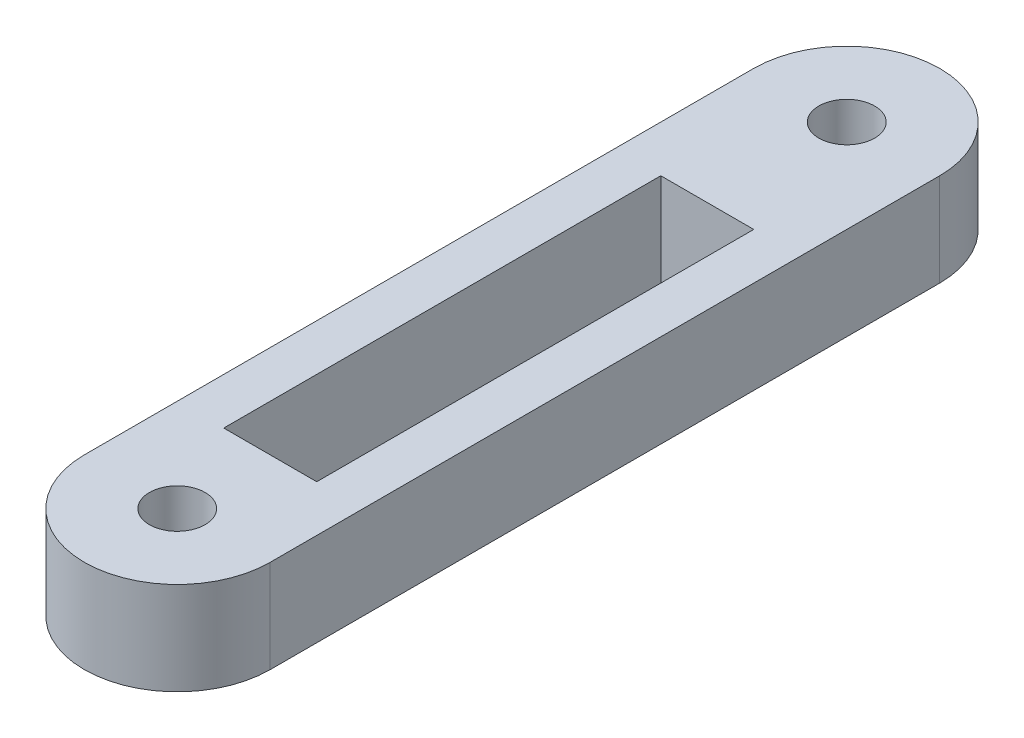
from build123d import *

# Parameters (mm, degrees)
EXTRUDE_1_DEPTH     = 5
SKETCH_3_W          = 5
SKETCH_3_H          = 23.5
CUT_EXTRUDE_1_DEPTH = 5
SKETCH_4_R          = 1.5
CUT_EXTRUDE_2_DEPTH = 5


with BuildPart() as part:
    # 草图2 → 凸台-拉伸1 (new body)
    with BuildSketch(Plane(origin=(0, 0, 0), x_dir=(1, 0, 0), z_dir=(0, 1, 0))):
        with BuildLine():
            Line((5, 18), (5, -18))
            ThreePointArc((5, -18), (0, -23), (-5, -18))
            Line((-5, -18), (-5, 18))
            ThreePointArc((-5, 18), (0, 23), (5, 18))
        make_face()
    extrude(amount=EXTRUDE_1_DEPTH)

    # 草图3 → 切除-拉伸1 (cut)
    with BuildSketch(Plane.XZ):
        with Locations((0, 1.25)):
            Rectangle(SKETCH_3_W, SKETCH_3_H)
    extrude(amount=-CUT_EXTRUDE_1_DEPTH, mode=Mode.SUBTRACT)

    # 草图4 → 切除-拉伸2 (cut)
    with BuildSketch(Plane.XZ):
        with Locations(Location((0, 18, 0), (0, 0, 270))):
            Circle(SKETCH_4_R)
        with Locations(Location((0, -18, 0), (0, 0, 90))):
            Circle(SKETCH_4_R)
    extrude(amount=-CUT_EXTRUDE_2_DEPTH, mode=Mode.SUBTRACT)


solid = part.part
